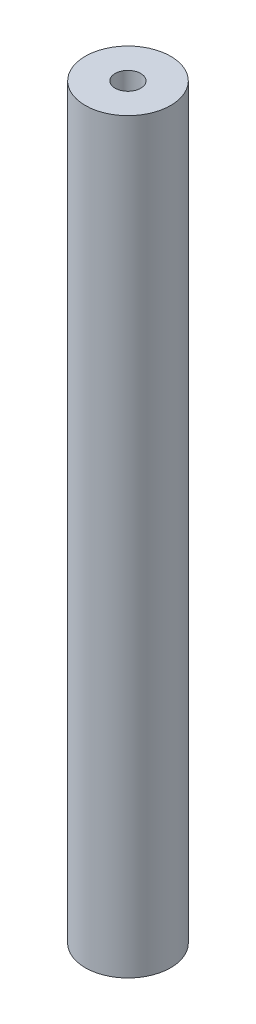
from build123d import *

# Parameters (mm, degrees)
SKETCH1_R                            = 5.08
BOSS_EXTRUDE1_DEPTH                  = 88.9
TAPPED_HOLE_FOR_4_40_HELICOIL1_D     = 3.048
TAPPED_HOLE_FOR_4_40_HELICOIL1_DEPTH = 8.128
TAPPED_HOLE_FOR_4_40_HELICOIL1_TIP   = 0.915711583
TAPPED_HOLE_FOR_4_40_HELICOIL2_D     = 3.048
TAPPED_HOLE_FOR_4_40_HELICOIL2_DEPTH = 8.128
TAPPED_HOLE_FOR_4_40_HELICOIL2_TIP   = 0.915711583


with BuildPart() as part:
    # Sketch1 → Boss-Extrude1 (new body)
    with BuildSketch(Plane(origin=(0, 0, 0), x_dir=(1, 0, 0), z_dir=(0, 1, 0))):
        with Locations(Location((0, 0, 0), (0, 0, 270))):
            Circle(SKETCH1_R)
    extrude(amount=BOSS_EXTRUDE1_DEPTH)

    # Tapped Hole for #4-40 Helicoil1
    with Locations(Plane(origin=(0, 88.9, 0), x_dir=(1, 0, 0), z_dir=(0, 1, 0))):
        with Locations((0, 0)):
            Hole(TAPPED_HOLE_FOR_4_40_HELICOIL1_D / 2, depth=TAPPED_HOLE_FOR_4_40_HELICOIL1_DEPTH)
            with Locations((0, 0, -(TAPPED_HOLE_FOR_4_40_HELICOIL1_DEPTH + TAPPED_HOLE_FOR_4_40_HELICOIL1_TIP / 2))):  # 118° drill point
                Cone(0, TAPPED_HOLE_FOR_4_40_HELICOIL1_D / 2, TAPPED_HOLE_FOR_4_40_HELICOIL1_TIP, mode=Mode.SUBTRACT)

    # Tapped Hole for #4-40 Helicoil2
    with Locations(Plane(origin=(0, 0, 0), x_dir=(-1, 0, 0), z_dir=(0, -1, 0))):
        with Locations((0, 0)):
            Hole(TAPPED_HOLE_FOR_4_40_HELICOIL2_D / 2, depth=TAPPED_HOLE_FOR_4_40_HELICOIL2_DEPTH)
            with Locations((0, 0, -(TAPPED_HOLE_FOR_4_40_HELICOIL2_DEPTH + TAPPED_HOLE_FOR_4_40_HELICOIL2_TIP / 2))):  # 118° drill point
                Cone(0, TAPPED_HOLE_FOR_4_40_HELICOIL2_D / 2, TAPPED_HOLE_FOR_4_40_HELICOIL2_TIP, mode=Mode.SUBTRACT)


solid = part.part
